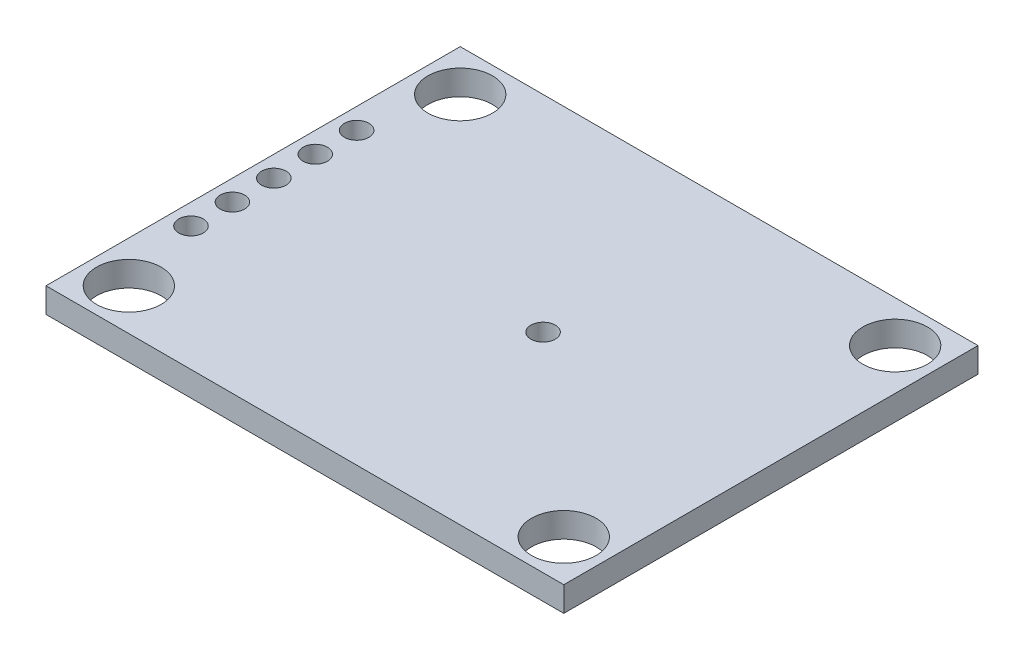
from build123d import *

# Parameters (mm, degrees)
SKETCH1_W           = 31.75
SKETCH1_H           = 25.4
BOSS_EXTRUDE1_DEPTH = 1.524
CUT_EXTRUDE1_REACH  = 22.387
SKETCH2_R           = 1.9812
CUT_EXTRUDE2_REACH  = 22.387
SKETCH3_R           = 0.75
LPATTERN1_COUNT     = 5
LPATTERN1_PITCH     = 2.54
CUT_EXTRUDE3_REACH  = 22.387
SKETCH4_R           = 0.7493


with BuildPart() as part:
    # Sketch1 → Boss-Extrude1 (new body)
    with BuildSketch(Plane(origin=(0, 0, 0), x_dir=(1, 0, 0), z_dir=(0, 1, 0))):
        Rectangle(SKETCH1_W, SKETCH1_H)
    extrude(amount=BOSS_EXTRUDE1_DEPTH)

    # Sketch2 → Cut-Extrude1 (cut, up to next)
    with BuildSketch(Plane(origin=(0, 1.524, 0), x_dir=(1, 0, 0), z_dir=(0, 1, 0)), mode=Mode.PRIVATE) as cut_extrude1_sk1:
        with Locations(Location((-13.335, 10.16, 0), (0, 0, 270))):
            Circle(SKETCH2_R)
    cut_extrude1_tool1 = extrude(cut_extrude1_sk1.sketch, amount=-CUT_EXTRUDE1_REACH, mode=Mode.PRIVATE) & part.part
    # Sketch2 → Cut-Extrude1 (cut, up to next)
    with BuildSketch(Plane(origin=(0, 1.524, 0), x_dir=(1, 0, 0), z_dir=(0, 1, 0)), mode=Mode.PRIVATE) as cut_extrude1_sk2:
        with Locations(Location((13.335, 10.16, 0), (0, 0, 90))):
            Circle(SKETCH2_R)
    cut_extrude1_tool2 = extrude(cut_extrude1_sk2.sketch, amount=-CUT_EXTRUDE1_REACH, mode=Mode.PRIVATE) & part.part
    # Sketch2 → Cut-Extrude1 (cut, up to next)
    with BuildSketch(Plane(origin=(0, 1.524, 0), x_dir=(1, 0, 0), z_dir=(0, 1, 0)), mode=Mode.PRIVATE) as cut_extrude1_sk3:
        with Locations(Location((-13.335, -10.16, 0), (0, 0, 90))):
            Circle(SKETCH2_R)
    cut_extrude1_tool3 = extrude(cut_extrude1_sk3.sketch, amount=-CUT_EXTRUDE1_REACH, mode=Mode.PRIVATE) & part.part
    # Sketch2 → Cut-Extrude1 (cut, up to next)
    with BuildSketch(Plane(origin=(0, 1.524, 0), x_dir=(1, 0, 0), z_dir=(0, 1, 0)), mode=Mode.PRIVATE) as cut_extrude1_sk4:
        with Locations(Location((13.335, -10.16, 0), (0, 0, 270))):
            Circle(SKETCH2_R)
    cut_extrude1_tool4 = extrude(cut_extrude1_sk4.sketch, amount=-CUT_EXTRUDE1_REACH, mode=Mode.PRIVATE) & part.part
    add(cut_extrude1_tool1.solids().sort_by_distance((-13.335, 1.524, -10.16))[0], mode=Mode.SUBTRACT)
    add(cut_extrude1_tool2.solids().sort_by_distance((13.335, 1.524, -10.16))[0], mode=Mode.SUBTRACT)
    add(cut_extrude1_tool3.solids().sort_by_distance((-13.335, 1.524, 10.16))[0], mode=Mode.SUBTRACT)
    add(cut_extrude1_tool4.solids().sort_by_distance((13.335, 1.524, 10.16))[0], mode=Mode.SUBTRACT)

    # Sketch3 → Cut-Extrude2 (cut, up to next)
    with BuildSketch(Plane(origin=(0, 1.524, 0), x_dir=(1, 0, 0), z_dir=(0, 1, 0)), mode=Mode.PRIVATE) as cut_extrude2_sk1:
        with Locations(Location((-14.605, 5.08, 0), (0, 0, 270))):
            Circle(SKETCH3_R)
    cut_extrude2_tool1 = extrude(cut_extrude2_sk1.sketch, amount=-CUT_EXTRUDE2_REACH, mode=Mode.PRIVATE) & part.part
    cut_extrude2 = cut_extrude2_tool1.solids().sort_by_distance((-14.605, 1.524, -5.08))[0]
    add(cut_extrude2, mode=Mode.SUBTRACT)

    # LPattern1: Cut-Extrude2 ×5
    with Locations(*[(0, 0, i * LPATTERN1_PITCH) for i in range(1, LPATTERN1_COUNT)]):
        add(cut_extrude2, mode=Mode.SUBTRACT)

    # Sketch4 → Cut-Extrude3 (cut, up to next)
    with BuildSketch(Plane(origin=(0, 1.524, 0), x_dir=(1, 0, 0), z_dir=(0, 1, 0)), mode=Mode.PRIVATE) as cut_extrude3_sk1:
        with Locations(Location((1.8288, 0.0762, 0), (0, 0, 270))):
            Circle(SKETCH4_R)
    cut_extrude3_tool1 = extrude(cut_extrude3_sk1.sketch, amount=-CUT_EXTRUDE3_REACH, mode=Mode.PRIVATE) & part.part
    add(cut_extrude3_tool1.solids().sort_by_distance((1.8288, 1.524, -0.0762))[0], mode=Mode.SUBTRACT)


solid = part.part
